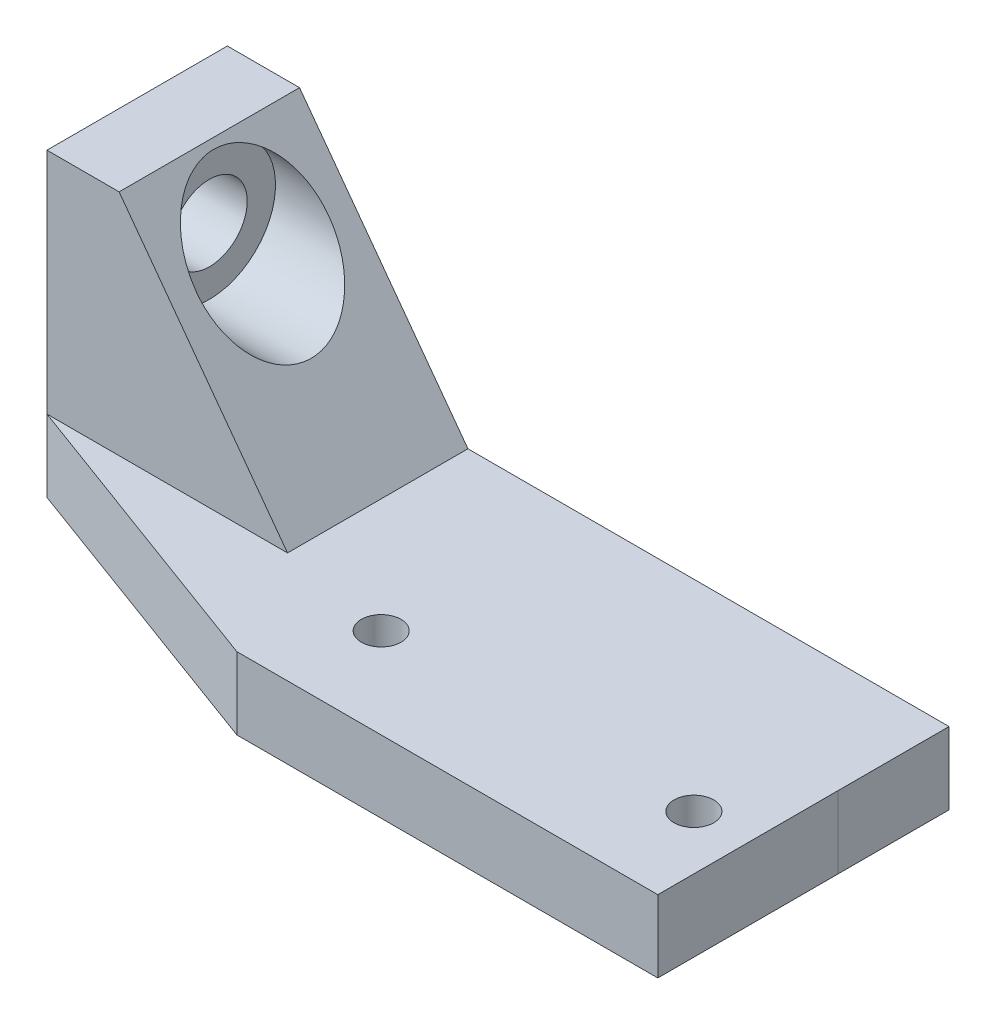
from build123d import *

# Parameters (mm, degrees)
SKETCH1_R           = 1.65
BOSS_EXTRUDE1_DEPTH = 6
SKETCH2_W           = 15
SKETCH2_H           = 25
SKETCH2_R           = 3.15
BOSS_EXTRUDE2_DEPTH = 20
CUT_EXTRUDE1_DEPTH  = 52.537692211
SKETCH5_R           = 5.5
CUT_EXTRUDE2_DEPTH  = 62.80841078


with BuildPart() as part:
    # Sketch1 → Boss-Extrude1 (new body)
    with BuildSketch(Plane(origin=(0, 0, 0), x_dir=(1, 0, 0), z_dir=(0, 1, 0))):
        Polygon((-17.5, -7.5), (17.5, -7.5), (17.5, 7.5), (17.50136804, 16.71166189), (-42.49863196, 16.71166189), (-42.49863196, 1.71166189), align=None)
        with Locations(Location((-13, 0, 0), (0, 0, 270))):
            Circle(SKETCH1_R, mode=Mode.SUBTRACT)
        with Locations(Location((13, 0, 0), (0, 0, 270))):
            Circle(SKETCH1_R, mode=Mode.SUBTRACT)
    extrude(amount=BOSS_EXTRUDE1_DEPTH)

    # Sketch2 → Boss-Extrude2 (add)
    with BuildSketch(Plane.ZY.offset(42.49863196)):
        with Locations((-9.21166189, 12.5)):
            Rectangle(SKETCH2_W, SKETCH2_H)
        with Locations((-9.21166189, 19)):
            Circle(SKETCH2_R, mode=Mode.SUBTRACT)
    extrude(amount=-BOSS_EXTRUDE2_DEPTH)

    # Sketch4 → Cut-Extrude1 (cut, through all)
    with BuildSketch(Plane.XY.offset(-1.71166189)):
        Polygon((-36.49863196, 25), (-22.49863196, 6), (-22.49863196, 25), align=None)
    extrude(amount=-CUT_EXTRUDE1_DEPTH, mode=Mode.SUBTRACT)

    # Sketch5 → Cut-Extrude2 (cut, through all)
    with BuildSketch(Plane.ZY.offset(36.49863196)):
        with Locations((-9.21166189, 19)):
            Circle(SKETCH5_R)
    extrude(amount=-CUT_EXTRUDE2_DEPTH, mode=Mode.SUBTRACT)


solid = part.part
